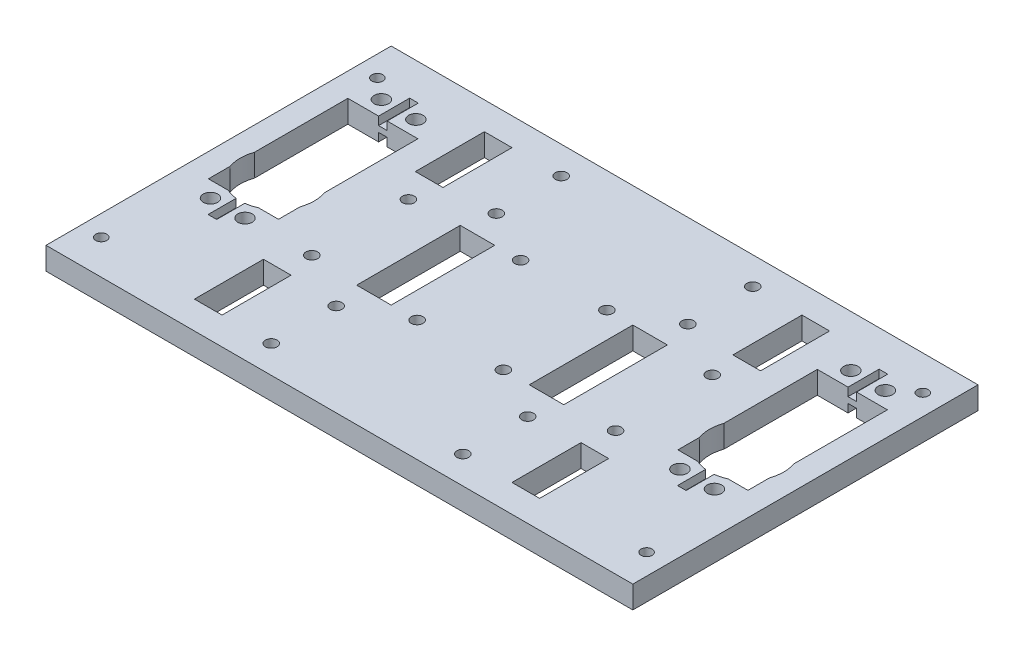
from build123d import *

# Parameters (mm, degrees)
SKETCH_1_W           = 100
SKETCH_1_H           = 100
EXTRUDE_1_DEPTH      = 6.5
SKETCH_2_W           = 5
SKETCH_2_H           = 100
EXTRUDE_2_DEPTH      = 75
SKETCH_3_R           = 2.25
CUT_EXTRUDE_1_DEPTH  = 85
SKETCH_4_W           = 40
SKETCH_4_H           = 41.42
CUT_EXTRUDE_2_DEPTH  = 85
CHAMFER_1_SIZE       = 10
SKETCH_5_W           = 10
SKETCH_5_H           = 30
CUT_EXTRUDE_3_DEPTH  = 85
SKETCH_11_R          = 1.7
CUT_EXTRUDE_5_DEPTH  = 10
SKETCH_12_R          = 1.7
CUT_EXTRUDE_6_DEPTH  = 25
SKETCH_13_R          = 2.3
SKETCH_13_R_2        = 15
CUT_EXTRUDE_9_DEPTH  = 105
SKETCH_14_W          = 15
SKETCH_14_H          = 41.42
CUT_EXTRUDE_10_DEPTH = 83
SKETCH_15_W          = 38.97610678
SKETCH_15_H          = 41.42
CUT_EXTRUDE_11_DEPTH = 83
SKETCH_16_R          = 1.7
CUT_EXTRUDE_12_DEPTH = 83
SKETCH_17_R          = 2.15
CUT_EXTRUDE_13_DEPTH = 83
CHAMFER_2_SIZE       = 8
SKETCH_18_W          = 143.568344584
SKETCH_18_H          = 92.865991502
CUT_EXTRUDE_14_DEPTH = 55
SKETCH_19_W          = 35
SKETCH_19_H          = 100
EXTRUDE_3_DEPTH      = 6.5
SKETCH_21_R          = 10.75
CUT_EXTRUDE_16_DEPTH = 10
SKETCH_20_R          = 2.1
CUT_EXTRUDE_15_DEPTH = 7.5
SKETCH_23_W          = 20.3
SKETCH_23_H          = 40.4
CUT_EXTRUDE_17_DEPTH = 20
SKETCH_24_W          = 2.5
SKETCH_24_H          = 18
CUT_EXTRUDE_18_DEPTH = 2.4
SKETCH_25_R          = 1.6
CUT_EXTRUDE_19_DEPTH = 10
SKETCH_26_W          = 8
SKETCH_26_H          = 20
CUT_EXTRUDE_20_DEPTH = 23


with BuildPart() as part:
    # 草图1 → 凸台-拉伸1 (new body)
    with BuildSketch(Plane(origin=(0, 0, 0), x_dir=(1, 0, 0), z_dir=(0, 1, 0))):
        Rectangle(SKETCH_1_W, SKETCH_1_H)
    extrude(amount=EXTRUDE_1_DEPTH)

    # 草图2 → 凸台-拉伸2 (add)
    with BuildSketch(Plane.XZ):
        with Locations((-34.5, 0)):
            Rectangle(SKETCH_2_W, SKETCH_2_H)
        with Locations((34.5, 0)):
            Rectangle(SKETCH_2_W, SKETCH_2_H)
    extrude(amount=EXTRUDE_2_DEPTH)

    # 草图3 → 切除-拉伸1 (cut)
    with BuildSketch(Plane.ZY.offset(37)):
        with Locations((-4.925, -12)):
            Circle(SKETCH_3_R)
        with Locations((4.925, -12)):
            Circle(SKETCH_3_R)
        with Locations((-4.925, -61.42)):
            Circle(SKETCH_3_R)
        with Locations((4.925, -61.42)):
            Circle(SKETCH_3_R)
        with Locations((14.773492699, -12.172312361)):
            Circle(SKETCH_3_R)
        with Locations((14.773492699, -61.247687639)):
            Circle(SKETCH_3_R)
        with Locations((-14.773492699, -61.247687639)):
            Circle(SKETCH_3_R)
        with Locations((-14.773492699, -12.172312361)):
            Circle(SKETCH_3_R)
    extrude(amount=-CUT_EXTRUDE_1_DEPTH, mode=Mode.SUBTRACT)

    # 草图4 → 切除-拉伸2 (cut)
    with BuildSketch(Plane.ZY.offset(37)):
        with Locations((0, -36.71)):
            Rectangle(SKETCH_4_W, SKETCH_4_H)
    extrude(amount=-CUT_EXTRUDE_2_DEPTH, mode=Mode.SUBTRACT)

    # 倒角1
    chamfer_1_edges = [part.edges().sort_by_distance(p)[0] for p in [
        (-34.5, -75, 50),
        (-34.5, -75, -50),
        (34.5, -75, 50),
        (34.5, -75, -50),
    ]]
    chamfer(chamfer_1_edges, length=CHAMFER_1_SIZE)

    # 草图5 → 切除-拉伸3 (cut)
    with BuildSketch(Plane(origin=(0, 6.5, 0), x_dir=(1, 0, 0), z_dir=(0, 1, 0))):
        with Locations((-25, 0)):
            Rectangle(SKETCH_5_W, SKETCH_5_H)
        with Locations((25, 0)):
            Rectangle(SKETCH_5_W, SKETCH_5_H)
    extrude(amount=-CUT_EXTRUDE_3_DEPTH, mode=Mode.SUBTRACT)

    # 草图11 → 切除-拉伸5 (cut)
    with BuildSketch(Plane.XZ):
        with Locations(Location((-44, 38, 0), (0, 0, 270))):
            Circle(SKETCH_11_R)
        with Locations(Location((-44, 26, 0), (0, 0, 270))):
            Circle(SKETCH_11_R)
        with Locations(Location((-44, 14, 0), (0, 0, 270))):
            Circle(SKETCH_11_R)
        with Locations(Location((44, 14, 0), (0, 0, 270))):
            Circle(SKETCH_11_R)
        with Locations(Location((44, 26, 0), (0, 0, 270))):
            Circle(SKETCH_11_R)
        with Locations(Location((44, 38, 0), (0, 0, 270))):
            Circle(SKETCH_11_R)
        with Locations(Location((44, -38, 0), (0, 0, 270))):
            Circle(SKETCH_11_R)
        with Locations(Location((44, -26, 0), (0, 0, 270))):
            Circle(SKETCH_11_R)
        with Locations(Location((44, -14, 0), (0, 0, 270))):
            Circle(SKETCH_11_R)
        with Locations(Location((-44, -14, 0), (0, 0, 270))):
            Circle(SKETCH_11_R)
        with Locations(Location((-44, -26, 0), (0, 0, 270))):
            Circle(SKETCH_11_R)
        with Locations(Location((-44, -38, 0), (0, 0, 270))):
            Circle(SKETCH_11_R)
    extrude(amount=-CUT_EXTRUDE_5_DEPTH, mode=Mode.SUBTRACT)

    # 草图12 → 切除-拉伸6 (cut)
    with BuildSketch(Plane(origin=(0, 6.5, 0), x_dir=(1, 0, 0), z_dir=(0, 1, 0))):
        with Locations(Location((-27.75, 42, 0), (0, 0, 270))):
            Circle(SKETCH_12_R)
        with Locations(Location((-27.75, 23.2, 0), (0, 0, 270))):
            Circle(SKETCH_12_R)
        with Locations(Location((27.75, 23.2, 0), (0, 0, 90))):
            Circle(SKETCH_12_R)
        with Locations(Location((27.75, 42, 0), (0, 0, 90))):
            Circle(SKETCH_12_R)
        with Locations(Location((27.75, -42, 0), (0, 0, 270))):
            Circle(SKETCH_12_R)
        with Locations(Location((27.75, -23.2, 0), (0, 0, 270))):
            Circle(SKETCH_12_R)
        with Locations(Location((-27.75, -23.2, 0), (0, 0, 90))):
            Circle(SKETCH_12_R)
        with Locations(Location((-27.75, -42, 0), (0, 0, 90))):
            Circle(SKETCH_12_R)
    extrude(amount=-CUT_EXTRUDE_6_DEPTH, mode=Mode.SUBTRACT)

    # 草图13 → 切除-拉伸9 (cut)
    with BuildSketch(Plane.ZY.offset(37)):
        with Locations((46, -16)):
            Circle(SKETCH_13_R)
        with Locations((46, -51)):
            Circle(SKETCH_13_R)
        with Locations((46, -33.5)):
            Circle(SKETCH_13_R_2)
    extrude(amount=-CUT_EXTRUDE_9_DEPTH, mode=Mode.SUBTRACT)

    # 草图14 → 切除-拉伸10 (cut)
    with BuildSketch(Plane.ZY.offset(37)):
        with Locations((-27.5, -36.71)):
            Rectangle(SKETCH_14_W, SKETCH_14_H)
    extrude(amount=-CUT_EXTRUDE_10_DEPTH, mode=Mode.SUBTRACT)

    # 草图15 → 切除-拉伸11 (cut)
    with BuildSketch(Plane.ZY.offset(37)):
        with Locations((-35, -36.71)):
            Rectangle(SKETCH_15_W, SKETCH_15_H)
    extrude(amount=-CUT_EXTRUDE_11_DEPTH, mode=Mode.SUBTRACT)

    # 草图16 → 切除-拉伸12 (cut)
    with BuildSketch(Plane(origin=(0, 6.5, 0), x_dir=(1, 0, 0), z_dir=(0, 1, 0))):
        with Locations(Location((-12.5, 15, 0), (0, 0, 270))):
            Circle(SKETCH_16_R)
        with Locations(Location((12.5, 15, 0), (0, 0, 90))):
            Circle(SKETCH_16_R)
        with Locations(Location((12.5, -15, 0), (0, 0, 270))):
            Circle(SKETCH_16_R)
        with Locations(Location((-12.5, -15, 0), (0, 0, 90))):
            Circle(SKETCH_16_R)
    extrude(amount=-CUT_EXTRUDE_12_DEPTH, mode=Mode.SUBTRACT)

    # 草图17 → 切除-拉伸13 (cut)
    with BuildSketch(Plane.ZY.offset(37)):
        with Locations((-24.623492699, -12.172312361)):
            Circle(SKETCH_17_R)
        with Locations((-24.625, -61.42)):
            Circle(SKETCH_17_R)
        with Locations((-39.622497813, -11.999553542)):
            Circle(SKETCH_17_R)
        with Locations((-39.622497813, -61.420446458)):
            Circle(SKETCH_17_R)
    extrude(amount=-CUT_EXTRUDE_13_DEPTH, mode=Mode.SUBTRACT)

    # 倒角2
    chamfer_2_edges = [part.edges().sort_by_distance(p)[0] for p in [
        (34.5, -16, -50),
        (-34.5, -16, -50),
    ]]
    chamfer(chamfer_2_edges, length=CHAMFER_2_SIZE)

    # 草图18 → 切除-拉伸14 (cut, symmetric)
    with BuildSketch(Plane(origin=(0, 0, 0), x_dir=(0, 0, -1), z_dir=(1, 0, 0))):
        with Locations((21.784172292, -46.432995751)):
            Rectangle(SKETCH_18_W, SKETCH_18_H)
    extrude(amount=CUT_EXTRUDE_14_DEPTH, both=True, mode=Mode.SUBTRACT)

    # 草图19 → 凸台-拉伸3 (add)
    with BuildSketch(Plane(origin=(0, 0, 0), x_dir=(1, 0, 0), z_dir=(0, 1, 0))):
        with Locations((-67.5, 0)):
            Rectangle(SKETCH_19_W, SKETCH_19_H)
        with Locations((67.5, 0)):
            Rectangle(SKETCH_19_W, SKETCH_19_H)
    extrude(amount=EXTRUDE_3_DEPTH)

    # 草图21 → 切除-拉伸16 (cut)
    with BuildSketch(Plane.XZ):
        with Locations(Location((-68, 0, 0), (0, 0, 270))):
            Circle(SKETCH_21_R)
        with Locations(Location((68, 0, 0), (0, 0, 270))):
            Circle(SKETCH_21_R)
    extrude(amount=-CUT_EXTRUDE_16_DEPTH, mode=Mode.SUBTRACT)

    # 草图20 → 切除-拉伸15 (cut, symmetric)
    with BuildSketch(Plane(origin=(0, 6.5, 0), x_dir=(1, 0, 0), z_dir=(0, 1, 0))):
        with Locations(Location((-63, -14.35, 0), (0, 0, 90))):
            Circle(SKETCH_20_R)
        with Locations(Location((-73, -14.35, 0), (0, 0, 90))):
            Circle(SKETCH_20_R)
        with Locations(Location((-73, 35.15, 0), (0, 0, 90))):
            Circle(SKETCH_20_R)
        with Locations(Location((-63, 35.15, 0), (0, 0, 90))):
            Circle(SKETCH_20_R)
        with Locations(Location((63, 35.15, 0), (0, 0, 90))):
            Circle(SKETCH_20_R)
        with Locations(Location((73, 35.15, 0), (0, 0, 90))):
            Circle(SKETCH_20_R)
        with Locations(Location((73, -14.35, 0), (0, 0, 90))):
            Circle(SKETCH_20_R)
        with Locations(Location((63, -14.35, 0), (0, 0, 90))):
            Circle(SKETCH_20_R)
    extrude(amount=CUT_EXTRUDE_15_DEPTH, both=True, mode=Mode.SUBTRACT)

    # 草图23 → 切除-拉伸17 (cut)
    with BuildSketch(Plane(origin=(0, 6.5, 0), x_dir=(1, 0, 0), z_dir=(0, 1, 0))):
        with Locations((-68, 10.4)):
            Rectangle(SKETCH_23_W, SKETCH_23_H)
        with Locations((68, 10.4)):
            Rectangle(SKETCH_23_W, SKETCH_23_H)
    extrude(amount=-CUT_EXTRUDE_17_DEPTH, mode=Mode.SUBTRACT)

    # 草图24 → 切除-拉伸18 (cut)
    with BuildSketch(Plane(origin=(0, 6.5, 0), x_dir=(1, 0, 0), z_dir=(0, 1, 0))):
        with Locations((-68, 30.6)):
            Rectangle(SKETCH_24_W, SKETCH_24_H)
        with Locations((68, 30.6)):
            Rectangle(SKETCH_24_W, SKETCH_24_H)
        with Locations((68, -9.8)):
            Rectangle(SKETCH_24_W, SKETCH_24_H)
        with Locations((-68, -9.8)):
            Rectangle(SKETCH_24_W, SKETCH_24_H)
    cut_extrude_18 = extrude(amount=-CUT_EXTRUDE_18_DEPTH, mode=Mode.SUBTRACT)

    # 草图25 → 切除-拉伸19 (cut)
    with BuildSketch(Plane(origin=(0, 6.5, 0), x_dir=(1, 0, 0), z_dir=(0, 1, 0))):
        with Locations(Location((-79, 40, 0), (0, 0, 270))):
            Circle(SKETCH_25_R)
        with Locations((-87.320502943, 27.519245585)):
            Circle(SKETCH_25_R)
        with Locations((87.320502943, 27.519245585)):
            Circle(SKETCH_25_R)
        with Locations(Location((79, 40, 0), (0, 0, 90))):
            Circle(SKETCH_25_R)
        with Locations(Location((79, -40, 0), (0, 0, 270))):
            Circle(SKETCH_25_R)
        with Locations((87.320502943, -27.519245585)):
            Circle(SKETCH_25_R)
        with Locations((-87.320502943, -27.519245585)):
            Circle(SKETCH_25_R)
        with Locations(Location((-79, -40, 0), (0, 0, 90))):
            Circle(SKETCH_25_R)
    extrude(amount=-CUT_EXTRUDE_19_DEPTH, mode=Mode.SUBTRACT)

    # 草图26 → 切除-拉伸20 (cut)
    with BuildSketch(Plane(origin=(0, 6.5, 0), x_dir=(1, 0, 0), z_dir=(0, 1, 0))):
        with Locations((-46, -32)):
            Rectangle(SKETCH_26_W, SKETCH_26_H)
        with Locations((46, -32)):
            Rectangle(SKETCH_26_W, SKETCH_26_H)
        with Locations((46, 32)):
            Rectangle(SKETCH_26_W, SKETCH_26_H)
        with Locations((-46, 32)):
            Rectangle(SKETCH_26_W, SKETCH_26_H)
    extrude(amount=-CUT_EXTRUDE_20_DEPTH, mode=Mode.SUBTRACT)

    # 镜向1: 切除-拉伸18 across plane
    add(cut_extrude_18.mirror(Plane.ZX.offset(3.25)), mode=Mode.SUBTRACT)


solid = part.part
